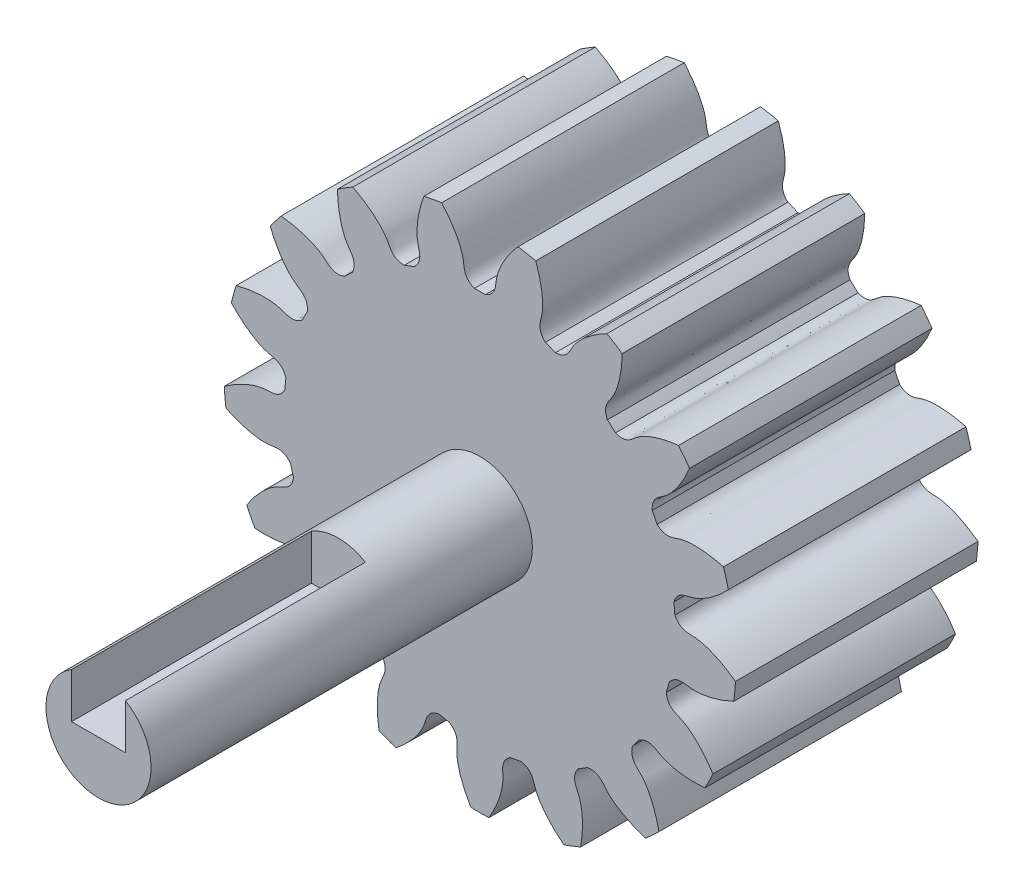
from build123d import *

# Parameters (mm, degrees)
SKETCH_1_R               = 19
EXTRUDE_1_DEPTH          = 18
CUT_EXTRUDE_1_DEPTH      = 33.341923258
PATTERN_CIRCULAR_1_COUNT = 17
SKETCH_4_R               = 3.9
EXTRUDE_3_DEPTH          = 10.5
EXTRUDE_4_DEPTH          = 17.8


with BuildPart() as part:
    # 草图1 → 凸台-拉伸1 (new body)
    with BuildSketch(Plane.XY):
        Circle(SKETCH_1_R)
    extrude(amount=EXTRUDE_1_DEPTH)

    # 草图2 → 切除-拉伸1 (cut, through all)
    with BuildSketch(Plane.XY):
        with BuildLine():
            ThreePointArc((0.403387494, 14.494387829), (0, 14.5), (-0.403387494, 14.494387829))
            add(Edge.make_bspline(
                [(-0.403387494, 14.494387829), (-1.255759481, 14.849644042), (-1.132390756, 15.509626813), (-1.276611209, 16.129648275), (-1.289951469, 16.18230119), (-1.306037005, 16.240838627), (-1.32510118, 16.305170665), (-1.347383555, 16.375198727), (-1.373118159, 16.450817515), (-1.40253689, 16.531914502), (-1.435868224, 16.618370188), (-1.473337358, 16.710058129), (-1.515165928, 16.80684504), (-1.561571855, 16.908590882), (-1.612769151, 17.015148962), (-1.66896775, 17.12636603), (-1.730373323, 17.242082389), (-1.797187111, 17.362132), (-1.869605751, 17.4863426), (-1.947821109, 17.61453582), (-2.032020115, 17.746527309), (-2.1223846, 17.882126855), (-2.219091138, 18.021138524), (-2.32231089, 18.163360791), (-2.432209452, 18.308586678), (-2.548946705, 18.456603899), (-2.67267667, 18.607195006), (-2.803547366, 18.760137539), (-2.941700674, 18.915204179), (-3.087272199, 19.072162909), (-3.24039114, 19.23077717), (-3.401180166, 19.390806026), (-3.569755292, 19.552004336), (-3.746225758, 19.71412292), (-3.930693918, 19.876908731), (-4.123255131, 20.040105038), (-4.323997649, 20.203451599), (-4.533002522, 20.366684847), (-4.750343497, 20.529538073), (-4.976086928, 20.691741613), (-5.210291694, 20.853023038), (-5.453009069, 21.013107349), (-5.79164327, 21.226861067), (-6.053153804, 21.381051942), (-6.231291666, 21.481438237)],
                knots=[0, 0, 0, 0, 0.193882922, 0.199023975, 0.204850501, 0.211362501, 0.218559975, 0.226442923, 0.235011345, 0.24426524, 0.254204608, 0.264829451, 0.276139767, 0.288135557, 0.300816821, 0.314183558, 0.328235769, 0.342973453, 0.358396612, 0.374505244, 0.39129935, 0.408778929, 0.426943982, 0.445794509, 0.46533051, 0.485551984, 0.506458932, 0.528051354, 0.550329249, 0.573292619, 0.596941461, 0.621275778, 0.646295568, 0.672000832, 0.69839157, 0.725467781, 0.753229466, 0.781676625, 0.810809257, 0.840627364, 0.871130943, 0.902319997, 0.934194524, 1, 1, 1, 1], degree=3))
            ThreePointArc((-6.231291666, 21.481438237), (0, 22.366966369), (6.231291666, 21.481438237))
            add(Edge.make_bspline(
                [(0.403387494, 14.494387829), (1.255759481, 14.849644042), (1.132390756, 15.509626813), (1.276611209, 16.129648275), (1.289951469, 16.18230119), (1.306037005, 16.240838627), (1.32510118, 16.305170665), (1.347383555, 16.375198727), (1.373118159, 16.450817515), (1.40253689, 16.531914502), (1.435868224, 16.618370188), (1.473337358, 16.710058129), (1.515165928, 16.80684504), (1.561571855, 16.908590882), (1.612769151, 17.015148962), (1.66896775, 17.12636603), (1.730373323, 17.242082389), (1.797187111, 17.362132), (1.869605751, 17.4863426), (1.947821109, 17.61453582), (2.032020115, 17.746527309), (2.1223846, 17.882126855), (2.219091138, 18.021138524), (2.32231089, 18.163360791), (2.432209452, 18.308586678), (2.548946705, 18.456603899), (2.67267667, 18.607195006), (2.803547366, 18.760137539), (2.941700674, 18.915204179), (3.087272199, 19.072162909), (3.24039114, 19.23077717), (3.401180166, 19.390806026), (3.569755292, 19.552004336), (3.746225758, 19.71412292), (3.930693918, 19.876908731), (4.123255131, 20.040105038), (4.323997649, 20.203451599), (4.533002522, 20.366684847), (4.750343497, 20.529538073), (4.976086928, 20.691741613), (5.210291694, 20.853023038), (5.453009069, 21.013107349), (5.79164327, 21.226861067), (6.053153804, 21.381051942), (6.231291666, 21.481438237)],
                knots=[0, 0, 0, 0, 0.193882922, 0.199023975, 0.204850501, 0.211362501, 0.218559975, 0.226442923, 0.235011345, 0.24426524, 0.254204608, 0.264829451, 0.276139767, 0.288135557, 0.300816821, 0.314183558, 0.328235769, 0.342973453, 0.358396612, 0.374505244, 0.39129935, 0.408778929, 0.426943982, 0.445794509, 0.46533051, 0.485551984, 0.506458932, 0.528051354, 0.550329249, 0.573292619, 0.596941461, 0.621275778, 0.646295568, 0.672000832, 0.69839157, 0.725467781, 0.753229466, 0.781676625, 0.810809257, 0.840627364, 0.871130943, 0.902319997, 0.934194524, 1, 1, 1, 1], degree=3))
        make_face()
    cut_extrude_1 = extrude(amount=CUT_EXTRUDE_1_DEPTH, mode=Mode.SUBTRACT)

    # 阵列(圆周)1: 切除-拉伸1 ×17 about axis
    pattern_circular_1_axis = Axis((0, 0, 18), (0, 0, -1))
    for i in range(1, PATTERN_CIRCULAR_1_COUNT):
        add(cut_extrude_1.rotate(pattern_circular_1_axis, i * 360 / PATTERN_CIRCULAR_1_COUNT), mode=Mode.SUBTRACT)

    # 草图4 → 凸台-拉伸3 (add)
    with BuildSketch(Plane.XY.offset(18)):
        Circle(SKETCH_4_R)
    extrude(amount=EXTRUDE_3_DEPTH)

    # 草图5 → 凸台-拉伸4 (add)
    with BuildSketch(Plane.XY.offset(28.5)):
        with BuildLine():
            Line((2, 0), (-2, 0))
            Line((-2, 0), (-2, 3.348133809))
            ThreePointArc((-2, 3.348133809), (-1.924837655, -3.391902121), (3.9, 0))
            ThreePointArc((3.9, 0), (3.391902121, 1.924837655), (2, 3.348133809))
            Line((2, 3.348133809), (2, 0))
        make_face()
    extrude(amount=EXTRUDE_4_DEPTH)


solid = part.part
